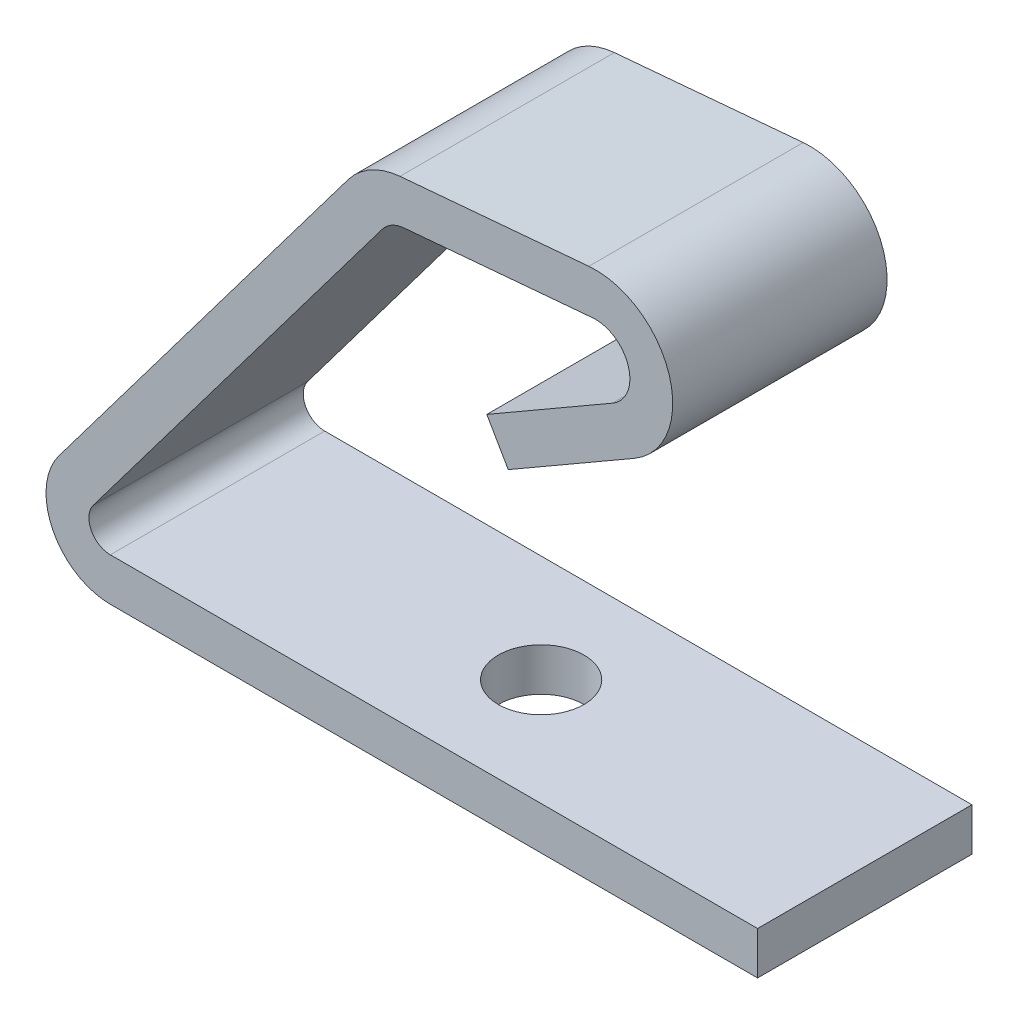
from build123d import *

# Parameters (mm, degrees)
EXTRUDE_THIN2_DEPTH = 5
CUT_EXTRUDE1_REACH  = 21.502
SKETCH2_R           = 1


with BuildPart() as part:
    # Sketch1 → Extrude-Thin2 (new body)
    with BuildSketch(Plane.XY):
        with BuildLine():
            Line((8.683836794, 7.227072274), (11.620904097, 8.922788872))
            ThreePointArc((11.620904097, 8.922788872), (11.983877658, 9.856173835), (11.151179503, 10.412564954))
            Line((11.151179503, 10.412564954), (6.74601462, 10.027162966))
            ThreePointArc((6.74601462, 10.027162966), (6.467656906, 9.942060472), (6.247978783, 9.751097193))
            Line((6.247978783, 9.751097193), (-0.496472901, 0.800907512))
            ThreePointArc((-0.496472901, 0.800907512), (-0.544622327, 0.276901093), (-0.097155146, 0))
            Line((-0.097155146, 0), (0, 0))
            Line((0, 0), (15, 0))
            Line((15, 0), (15, -1))
            Line((15, -1), (0, -1))
            Line((0, -1), (-0.097155146, -1))
            ThreePointArc((-0.097155146, -1), (-1.439556688, -0.16929672), (-1.295108411, 1.402722535))
            Line((-1.295108411, 1.402722535), (5.449343273, 10.352912216))
            ThreePointArc((5.449343273, 10.352912216), (5.982847286, 10.816680179), (6.658858877, 11.023357664))
            Line((6.658858877, 11.023357664), (11.064023761, 11.408759652))
            ThreePointArc((11.064023761, 11.408759652), (12.937594609, 10.156879635), (12.120904097, 8.056763469))
            Line((12.120904097, 8.056763469), (9.183836794, 6.36104687))
            Line((9.183836794, 6.36104687), (8.683836794, 7.227072274))
        make_face()
    extrude(amount=EXTRUDE_THIN2_DEPTH)

    # Sketch2 → Cut-Extrude1 (cut, up to next)
    with BuildSketch(Plane(origin=(0, 0, 0), x_dir=(1, 0, 0), z_dir=(0, 1, 0)), mode=Mode.PRIVATE) as cut_extrude1_sk1:
        with Locations(Location((7.451422427, -2.5, 0), (0, 0, 270))):
            Circle(SKETCH2_R)
    cut_extrude1_tool1 = extrude(cut_extrude1_sk1.sketch, amount=-CUT_EXTRUDE1_REACH, mode=Mode.PRIVATE) & part.part
    add(cut_extrude1_tool1.solids().sort_by_distance((7.451422, 0, 2.5))[0], mode=Mode.SUBTRACT)


solid = part.part
